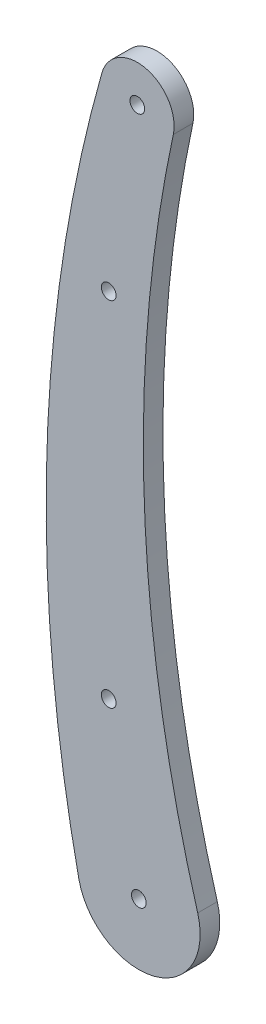
from build123d import *

# Parameters (mm, degrees)
SCHIZZO1_R                   = 1.5
ESTRUSIONE_ESTRUSIONE1_DEPTH = 4
SCHIZZO2_R                   = 1.5
TAGLIO_ESTRUSIONE1_DEPTH     = 25


with BuildPart() as part:
    # Schizzo1 → Estrusione-Estrusione1 (new body)
    with BuildSketch(Plane.XY):
        with BuildLine():
            ThreePointArc((7.023974797, 138.427683332), (1.499753731, 147.278176914), (-7.525391936, 142.044153534))
            ThreePointArc((-7.525391936, 142.044153534), (-18.729107246, 69.99949188), (-12.22229981, -2.620188418))
            ThreePointArc((-12.22229981, -2.620188418), (3.068449146, -12.117533571), (11.996332959, 3.512548298))
            ThreePointArc((11.996332959, 3.512548298), (1.102237583, 70.660238267), (7.023974797, 138.427683332))
        make_face()
        Circle(SCHIZZO1_R, mode=Mode.SUBTRACT)
        with Locations((-0.309434746, 139.999658036)):
            Circle(SCHIZZO1_R, mode=Mode.SUBTRACT)
    extrude(amount=ESTRUSIONE_ESTRUSIONE1_DEPTH)

    # Schizzo2 → Taglio-Estrusione1 (cut)
    with BuildSketch(Plane.XY.offset(4)):
        with Locations((-6.142115432, 104.166670735)):
            Circle(SCHIZZO2_R)
        with Locations((-6.142115432, 32.213749463)):
            Circle(SCHIZZO2_R)
    extrude(amount=-TAGLIO_ESTRUSIONE1_DEPTH, mode=Mode.SUBTRACT)


solid = part.part
